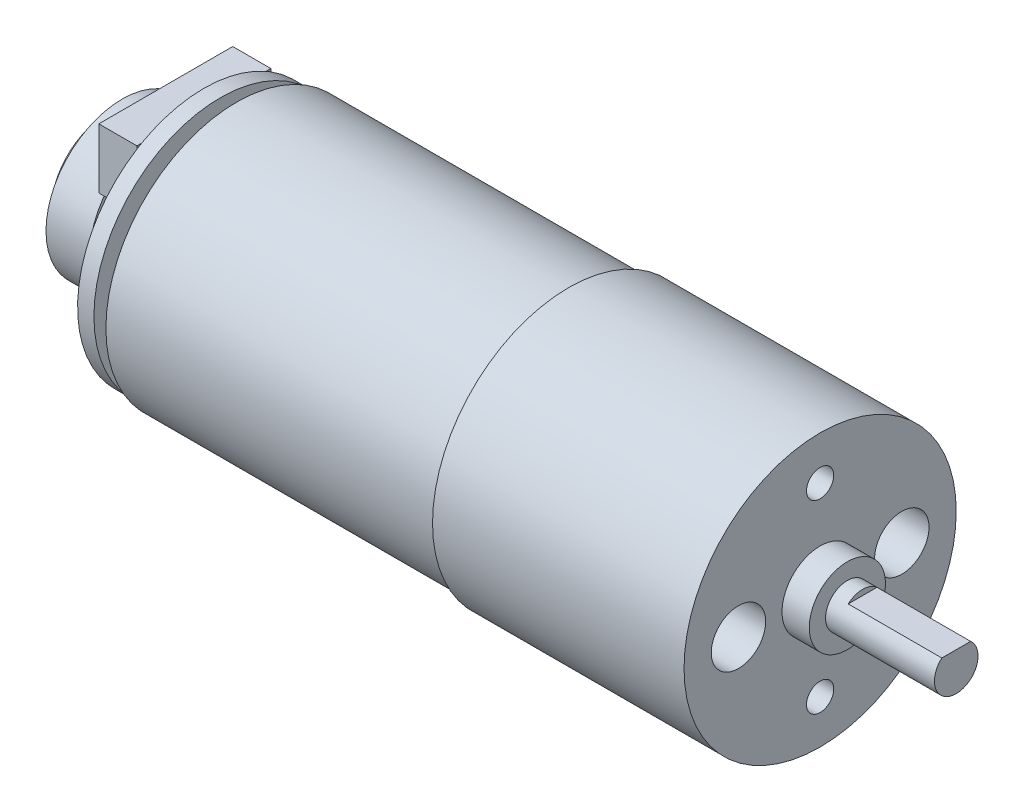
from build123d import *

# Parameters (mm, degrees)
SKETCH_4_R             = 12.5
EXTRUDE_481_DEPTH      = 53.6
SKETCH_6_R             = 2
EXTRUDE_595_DEPTH      = 12.5
SKETCH_8_W             = 11.304
SKETCH_8_H             = 8.543704008
CUT_EXTRUDE_852_DEPTH  = 0.5
SKETCH_10_R            = 3.5
EXTRUDE_1010_DEPTH     = 2.5
SKETCH_14_R            = 1.25
CUT_EXTRUDE_1321_DEPTH = 15
SKETCH_16_R            = 2.5
CUT_EXTRUDE_1436_DEPTH = 5
SKETCH_18_R            = 3.2
EXTRUDE_1549_DEPTH     = 1.5
SKETCH_21_R            = 11.6
EXTRUDE_1657_DEPTH     = 1.5
SKETCH_23_W            = 12.3
SKETCH_23_H            = 5.5
EXTRUDE_1848_DEPTH     = 3.5
SKETCH_25_W            = 5.1
SKETCH_25_H            = 2
EXTRUDE_2147_DEPTH     = 8
SKETCH_27_R            = 0.75
EXTRUDE_2397_DEPTH     = 3.5
SKETCH_32_R            = 7
EXTRUDE_2516_DEPTH     = 4
SKETCH_33_R            = 5
EXTRUDE_12_DEPTH       = 1
SKETCH_35_R            = 5
EXTRUDE_2731_DEPTH     = 1
SKETCH_37_R            = 1.5
CUT_EXTRUDE_2844_DEPTH = 2
SKETCH_40_OUTSIDE_W    = 44.146
SKETCH_40_OUTSIDE_H    = 44.146
SKETCH_40_OUTSIDE_R    = 12
CUT_EXTRUDE_2998_DEPTH = 30.5


with BuildPart() as part:
    # Эскиз4 → Extrude 481 (new body)
    with BuildSketch(Plane(origin=(0, 0, 0), x_dir=(0, 0, -1), z_dir=(1, 0, 0))):
        Circle(SKETCH_4_R)
    extrude(amount=EXTRUDE_481_DEPTH)

    # Эскиз6 → Extrude 595 (add)
    with BuildSketch(Plane(origin=(53.6, 0, 0), x_dir=(0, 0, -1), z_dir=(1, 0, 0))):
        Circle(SKETCH_6_R)
    extrude(amount=EXTRUDE_595_DEPTH)

    # Эскиз8 → Cut-Extrude 852 (cut)
    with BuildSketch(Plane(origin=(0, 2, 0), x_dir=(1, 0, 0), z_dir=(0, 1, 0))):
        with Locations((63.152390779, -0.470627763)):
            Rectangle(SKETCH_8_W, SKETCH_8_H)
    extrude(amount=-CUT_EXTRUDE_852_DEPTH, mode=Mode.SUBTRACT)

    # Эскиз10 → Extrude 1010 (add)
    with BuildSketch(Plane(origin=(53.6, 0, 0), x_dir=(0, 0, -1), z_dir=(1, 0, 0))):
        Circle(SKETCH_10_R)
    extrude(amount=EXTRUDE_1010_DEPTH)

    # Эскиз14 → Cut-Extrude 1321 (cut)
    with BuildSketch(Plane(origin=(53.6, 0, 0), x_dir=(0, 0, -1), z_dir=(1, 0, 0))):
        with Locations((0, 8.5)):
            Circle(SKETCH_14_R)
        with Locations((0, -8.5)):
            Circle(SKETCH_14_R)
    extrude(amount=-CUT_EXTRUDE_1321_DEPTH, mode=Mode.SUBTRACT)

    # Эскиз16 → Cut-Extrude 1436 (cut)
    with BuildSketch(Plane(origin=(53.6, 0, 0), x_dir=(0, 0, -1), z_dir=(1, 0, 0))):
        with Locations((-7.5, 0)):
            Circle(SKETCH_16_R)
        with Locations((7.5, 0)):
            Circle(SKETCH_16_R)
    extrude(amount=-CUT_EXTRUDE_1436_DEPTH, mode=Mode.SUBTRACT)

    # Эскиз18 → Extrude 1549 (add)
    with BuildSketch(Plane.ZY):
        with Locations(Location((0, 0, 0), (0, 0, 180))):
            Circle(SKETCH_18_R)
    extrude(amount=EXTRUDE_1549_DEPTH)

    # Эскиз21 → Extrude 1657 (add)
    with BuildSketch(Plane.ZY.offset(1.5)):
        Circle(SKETCH_21_R)
    extrude(amount=EXTRUDE_1657_DEPTH)

    # Эскиз23 → Extrude 1848 (add)
    with BuildSketch(Plane.ZY.offset(3)):
        with Locations((0, 7.35)):
            Rectangle(SKETCH_23_W, SKETCH_23_H)
    extrude(amount=EXTRUDE_1848_DEPTH)

    # Эскиз25 → Extrude 2147 (add)
    with BuildSketch(Plane.ZY.offset(3)):
        with Locations((0, -8.2)):
            Rectangle(SKETCH_25_W, SKETCH_25_H)
    extrude(amount=EXTRUDE_2147_DEPTH)

    # Эскиз27 → Extrude 2397 (add)
    with BuildSketch(Plane.ZY.offset(3)):
        Circle(SKETCH_27_R)
    extrude(amount=EXTRUDE_2397_DEPTH)

    # Эскиз32 → Extrude 2516 (add)
    with BuildSketch(Plane.ZY.offset(6.5)):
        with Locations(Location((0, 0, 0), (0, 0, 138.91766686))):
            Circle(SKETCH_32_R)
    extrude(amount=EXTRUDE_2516_DEPTH)

    # Эскиз35 → Extrude 2731 (add)
    with BuildSketch(Plane.ZY.offset(10.5)):
        Circle(SKETCH_35_R)
    extrude(amount=EXTRUDE_2731_DEPTH)


with BuildPart() as body_2:
    # Эскиз33 → Бобышка-Вытянуть12 (new body)
    with BuildSketch(Plane.ZY.offset(11)):
        Circle(SKETCH_33_R)
    extrude(amount=EXTRUDE_12_DEPTH)


with BuildPart() as cut_extrude_2844_tool:
    # Эскиз37 → Cut-Extrude 2844 (new body)
    with BuildSketch(Plane.ZY.offset(12)):
        Circle(SKETCH_37_R)
    extrude(amount=-CUT_EXTRUDE_2844_DEPTH)


with BuildPart() as part_1:
    add(part.part)

    # Cut-Extrude 2844: cut by cut_extrude_2844_tool
    add(cut_extrude_2844_tool.part, mode=Mode.SUBTRACT)

    # Эскиз40 outside → Cut-Extrude 2998 (cut)
    with BuildSketch(Plane.ZY):
        Rectangle(SKETCH_40_OUTSIDE_W, SKETCH_40_OUTSIDE_H)
        Circle(SKETCH_40_OUTSIDE_R, mode=Mode.SUBTRACT)
    extrude(amount=-CUT_EXTRUDE_2998_DEPTH, mode=Mode.SUBTRACT)


with BuildPart() as body_2_1:
    add(body_2.part)

    # Cut-Extrude 2844: cut by cut_extrude_2844_tool
    add(cut_extrude_2844_tool.part, mode=Mode.SUBTRACT)


solid = Compound([part_1.part, body_2_1.part])
